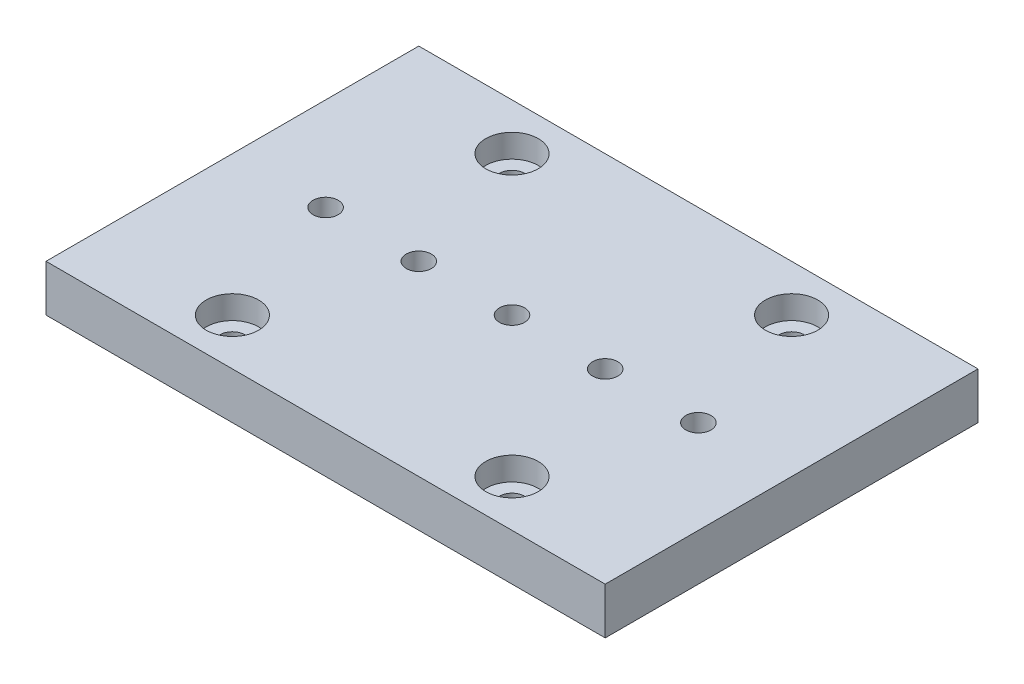
from build123d import *

# Parameters (mm, degrees)
SKETCH1_W                                            = 152.4
SKETCH1_H                                            = 101.6
BOSS_EXTRUDE1_DEPTH                                  = 12.7
CBORE_FOR_1_4_BINDING_HEAD_MACHINE_SCREW_D           = 6.858
CBORE_FOR_1_4_BINDING_HEAD_MACHINE_SCREW_CBORE_D     = 14.2875
CBORE_FOR_1_4_BINDING_HEAD_MACHINE_SCREW_CBORE_DEPTH = 6.35
F_1_4_0_25_DIAMETER_HOLE1_D                          = 6.858
CUT_EXTRUDE1_DEPTH                                   = 6.35


with BuildPart() as part:
    # Sketch1 → Boss-Extrude1 (new body)
    with BuildSketch(Plane(origin=(0, 0, 0), x_dir=(1, 0, 0), z_dir=(0, 1, 0))):
        Rectangle(SKETCH1_W, SKETCH1_H)
    extrude(amount=BOSS_EXTRUDE1_DEPTH)

    # CBORE for 1/4 Binding Head Machine Screw1 (through all)
    with Locations(Plane(origin=(0, 12.7, 0), x_dir=(1, 0, 0), z_dir=(0, 1, 0))):
        with Locations((-38.1, 38.1), (38.1, 38.1), (38.1, -38.1), (-38.1, -38.1)):
            CounterBoreHole(CBORE_FOR_1_4_BINDING_HEAD_MACHINE_SCREW_D / 2, CBORE_FOR_1_4_BINDING_HEAD_MACHINE_SCREW_CBORE_D / 2, CBORE_FOR_1_4_BINDING_HEAD_MACHINE_SCREW_CBORE_DEPTH)

    # 1/4 (0.25) Diameter Hole1 (through all)
    with Locations(Plane(origin=(0, 12.7, 0), x_dir=(1, 0, 0), z_dir=(0, 1, 0))):
        with Locations((0, 0), (25.4, 0), (50.8, 0), (-25.4, 0), (-50.8, 0)):
            Hole(F_1_4_0_25_DIAMETER_HOLE1_D / 2)

    # Sketch6 → Cut-Extrude1 (cut)
    with BuildSketch(Plane.XZ):
        Polygon((19.90725, -3.171240691), (25.4, -6.342481382), (30.89275, -3.171240691), (30.89275, 3.171240691), (25.4, 6.342481382), (19.90725, 3.171240691), align=None)
        Polygon((50.8, 6.342481382), (45.30725, 3.171240691), (45.30725, -3.171240691), (50.8, -6.342481382), (56.29275, -3.171240691), (56.29275, 3.171240691), align=None)
        Polygon((-5.49275, -3.171240691), (0, -6.342481382), (5.49275, -3.171240691), (5.49275, 3.171240691), (0, 6.342481382), (-5.49275, 3.171240691), align=None)
        Polygon((-30.89275, -3.171240691), (-25.4, -6.342481382), (-19.90725, -3.171240691), (-19.90725, 3.171240691), (-25.4, 6.342481382), (-30.89275, 3.171240691), align=None)
        Polygon((-56.29275, -3.171240691), (-50.8, -6.342481382), (-45.30725, -3.171240691), (-45.30725, 3.171240691), (-50.8, 6.342481382), (-56.29275, 3.171240691), align=None)
    extrude(amount=-CUT_EXTRUDE1_DEPTH, mode=Mode.SUBTRACT)


solid = part.part
